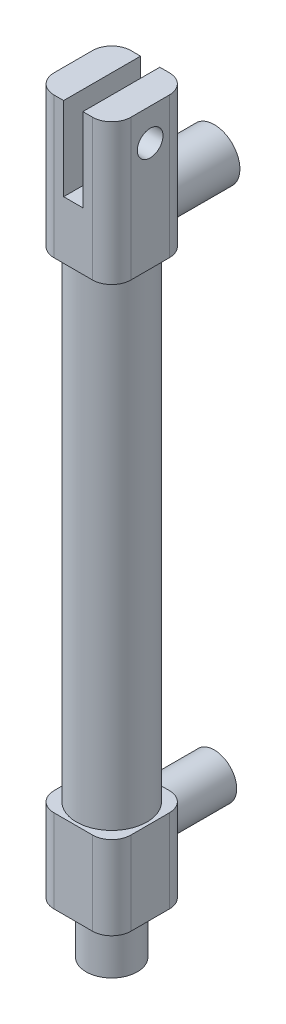
from build123d import *

# Parameters (mm, degrees)
SKETCH1_R           = 5.5
BOSS_EXTRUDE1_DEPTH = 75
BOSS_EXTRUDE2_DEPTH = 22
SKETCH3_R           = 2
CUT_EXTRUDE1_DEPTH  = 100.249870156
SKETCH4_W           = 3
SKETCH4_H           = 12
CUT_EXTRUDE2_DEPTH  = 13
SKETCH5_R           = 4
BOSS_EXTRUDE3_DEPTH = 10
BOSS_EXTRUDE4_START = 13
BOSS_EXTRUDE4_DEPTH = 13
SKETCH7_R           = 3.5
BOSS_EXTRUDE5_DEPTH = 10
SKETCH9_R           = 4
BOSS_EXTRUDE6_DEPTH = 8
SKETCH10_R          = 2
CUT_EXTRUDE3_DEPTH  = 80


with BuildPart() as part:
    # Sketch1 → Boss-Extrude1 (new body)
    with BuildSketch(Plane(origin=(0, 0, 0), x_dir=(1, 0, 0), z_dir=(0, 1, 0))):
        with Locations(Location((-60.059570612, 11.249252908, 0), (0, 0, 270))):
            Circle(SKETCH1_R)
    extrude(amount=BOSS_EXTRUDE1_DEPTH)

    # Sketch2 → Boss-Extrude2 (add)
    with BuildSketch(Plane(origin=(0, 75, 0), x_dir=(1, 0, 0), z_dir=(0, 1, 0))):
        with BuildLine():
            Line((-63.059570612, 17.249252908), (-57.059570612, 17.249252908))
            ThreePointArc((-57.059570612, 17.249252908), (-54.938250268, 16.370573252), (-54.059570612, 14.249252908))
            Line((-54.059570612, 14.249252908), (-54.059570612, 8.249252908))
            ThreePointArc((-54.059570612, 8.249252908), (-54.938250268, 6.127932565), (-57.059570612, 5.249252908))
            Line((-57.059570612, 5.249252908), (-63.059570612, 5.249252908))
            ThreePointArc((-63.059570612, 5.249252908), (-65.180890956, 6.127932565), (-66.059570612, 8.249252908))
            Line((-66.059570612, 8.249252908), (-66.059570612, 14.249252908))
            ThreePointArc((-66.059570612, 14.249252908), (-65.180890956, 16.370573252), (-63.059570612, 17.249252908))
        make_face()
    extrude(amount=BOSS_EXTRUDE2_DEPTH)

    # Sketch3 → Cut-Extrude1 (cut, through all)
    with BuildSketch(Plane.ZY.offset(66.059570612)):
        with Locations((-11.249252908, 92)):
            Circle(SKETCH3_R)
    extrude(amount=-CUT_EXTRUDE1_DEPTH, mode=Mode.SUBTRACT)

    # Sketch4 → Cut-Extrude2 (cut)
    with BuildSketch(Plane(origin=(0, 97, 0), x_dir=(1, 0, 0), z_dir=(0, 1, 0))):
        with Locations((-60.059570612, 11.249252908)):
            Rectangle(SKETCH4_W, SKETCH4_H)
    extrude(amount=-CUT_EXTRUDE2_DEPTH, mode=Mode.SUBTRACT)

    # Sketch5 → Boss-Extrude3 (add)
    with BuildSketch(Plane(origin=(0, 0, -17.249252908), x_dir=(-1, 0, 0), z_dir=(0, 0, -1))):
        with Locations(Location((60.059570612, 79.5, 0), (0, 0, 138.590377891))):
            Circle(SKETCH5_R)
    extrude(amount=BOSS_EXTRUDE3_DEPTH)

    # Sketch6 → Boss-Extrude4 (add)
    with BuildSketch(Plane.XZ.offset(BOSS_EXTRUDE4_START)):
        with BuildLine():
            Line((-57.059570612, -17.249252908), (-63.059570612, -17.249252908))
            ThreePointArc((-63.059570612, -17.249252908), (-65.180890956, -16.370573252), (-66.059570612, -14.249252908))
            Line((-66.059570612, -14.249252908), (-66.059570612, -8.249252908))
            ThreePointArc((-66.059570612, -8.249252908), (-65.180890956, -6.127932565), (-63.059570612, -5.249252908))
            Line((-63.059570612, -5.249252908), (-57.059570612, -5.249252908))
            ThreePointArc((-57.059570612, -5.249252908), (-54.938250268, -6.127932565), (-54.059570612, -8.249252908))
            Line((-54.059570612, -8.249252908), (-54.059570612, -14.249252908))
            ThreePointArc((-54.059570612, -14.249252908), (-54.938250268, -16.370573252), (-57.059570612, -17.249252908))
        make_face()
    extrude(amount=-BOSS_EXTRUDE4_DEPTH)

    # Sketch7 → Boss-Extrude5 (add)
    with BuildSketch(Plane(origin=(0, 0, -17.249252908), x_dir=(-1, 0, 0), z_dir=(0, 0, -1))):
        with Locations(Location((60.059570612, -4.5, 0), (0, 0, 148.997280866))):
            Circle(SKETCH7_R)
    extrude(amount=BOSS_EXTRUDE5_DEPTH)

    # Sketch9 → Boss-Extrude6 (add)
    with BuildSketch(Plane.XZ.offset(13)):
        with Locations(Location((-60.059570612, -11.249252908, 0), (0, 0, 90))):
            Circle(SKETCH9_R)
    extrude(amount=BOSS_EXTRUDE6_DEPTH)

    # Sketch10 → Cut-Extrude3 (cut)
    with BuildSketch(Plane.XZ.offset(21)):
        with Locations(Location((-60.059570612, -11.249252908, 0), (0, 0, 270))):
            Circle(SKETCH10_R)
    extrude(amount=-CUT_EXTRUDE3_DEPTH, mode=Mode.SUBTRACT)


solid = part.part
